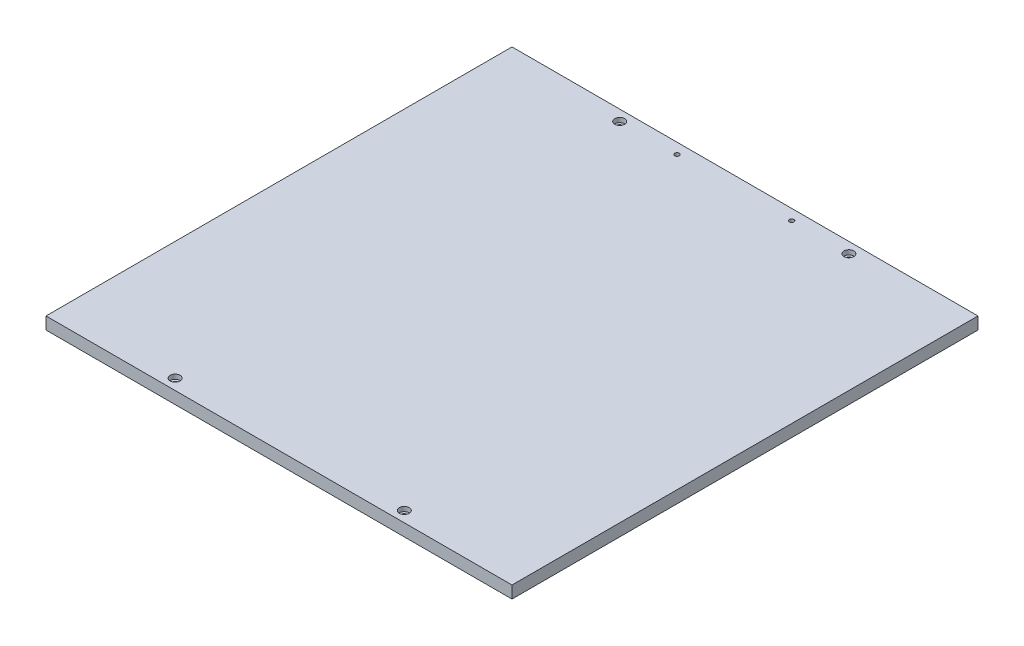
from build123d import *

# Parameters (mm, degrees)
SKETCH_1_W                     = 305
SKETCH_1_H                     = 305
EXTRUDE_1_DEPTH                = 8
HOLE_WIZARD_M1_6_1_D           = 3.4
HOLE_WIZARD_M1_6_1_CBORE_D     = 6.5
HOLE_WIZARD_M1_6_1_CBORE_DEPTH = 3
HOLE_WIZARD_M3_1_D             = 3


with BuildPart() as part:
    # 草图1 → 凸台-拉伸1 (new body)
    with BuildSketch(Plane(origin=(0, 0, 0), x_dir=(1, 0, 0), z_dir=(0, 1, 0))):
        Rectangle(SKETCH_1_W, SKETCH_1_H)
    extrude(amount=EXTRUDE_1_DEPTH)

    # M1.6 六角头螺栓的柱形沉头孔1 (through all)
    with Locations(Plane(origin=(0, 8, 0), x_dir=(1, 0, 0), z_dir=(0, 1, 0))):
        with Locations((-75, 145.5), (75, 145.5), (75, -145.5), (-75, -145.5)):
            CounterBoreHole(HOLE_WIZARD_M1_6_1_D / 2, HOLE_WIZARD_M1_6_1_CBORE_D / 2, HOLE_WIZARD_M1_6_1_CBORE_DEPTH)

    # M3 螺纹孔1 (through all)
    with Locations(Plane(origin=(-37.5, 8, -145.5), x_dir=(0, 0, 1), z_dir=(0, 1, 0))):
        with Locations((0, 0), (0, 75)):
            Hole(HOLE_WIZARD_M3_1_D / 2)


solid = part.part
